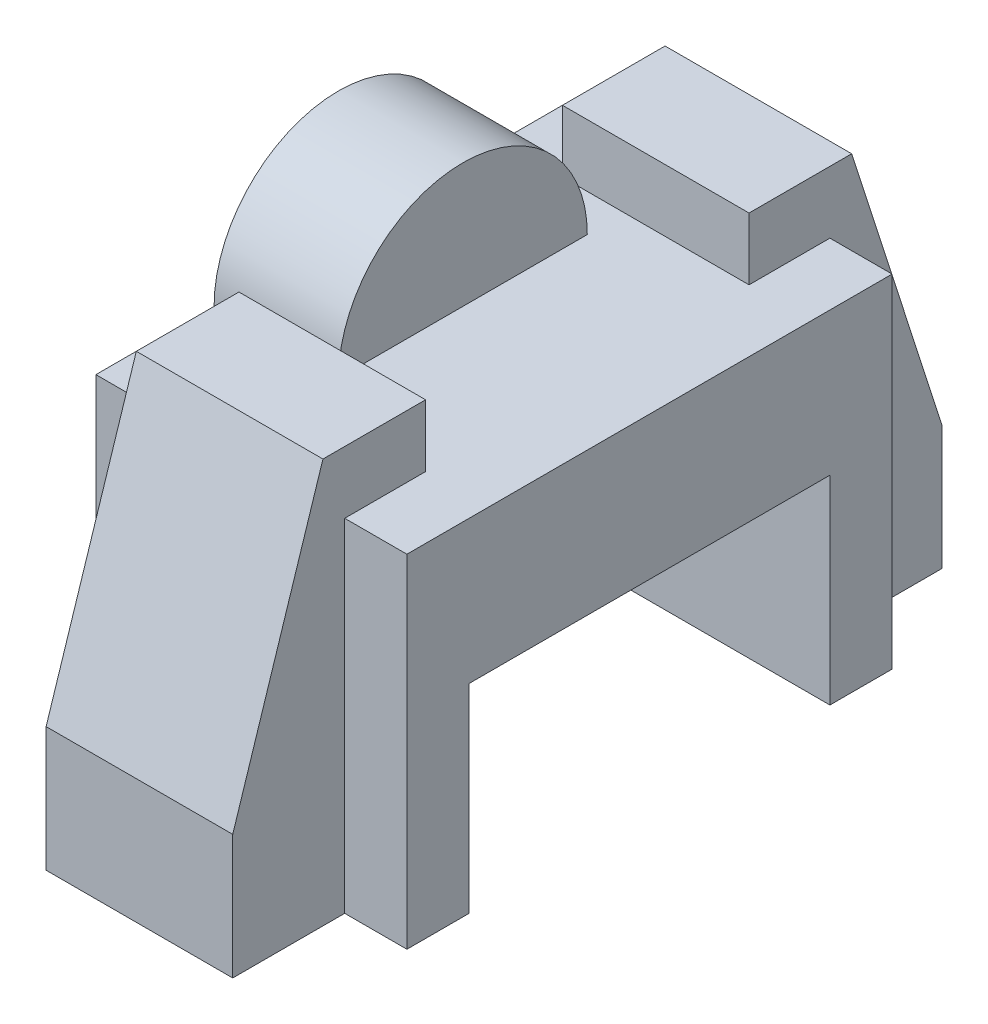
from build123d import *

# Parameters (mm, degrees)
SALIENTE_EXTRUIR1_DEPTH = 25
SALIENTE_EXTRUIR2_DEPTH = 15
SALIENTE_EXTRUIR3_START = -25
SALIENTE_EXTRUIR3_DEPTH = 20


with BuildPart() as part:
    # Croquis1 → Saliente-Extruir1 (new, symmetric)
    with BuildSketch(Plane(origin=(0, 0, 0), x_dir=(0, 0, -1), z_dir=(1, 0, 0))):
        Polygon((29, -27.5), (39, -27.5), (39, 27.5), (-39, 27.5), (-39, -27.5), (-29, -27.5), (-29, 4.5), (29, 4.5), align=None)
    extrude(amount=SALIENTE_EXTRUIR1_DEPTH, both=True)

    # Croquis2 → Saliente-Extruir2 (add, symmetric)
    with BuildSketch(Plane(origin=(0, 0, 0), x_dir=(0, 0, -1), z_dir=(1, 0, 0))):
        Polygon((-26, 27.5), (-26, 37.5), (-42.5, 37.5), (-57, -7.5), (-57, -27.5), (-39, -27.5), (-39, 27.5), align=None)
        Polygon((39, -27.5), (39, 27.5), (26, 27.5), (26, 37.5), (42.5, 37.5), (57, -7.5), (57, -27.5), align=None)
    extrude(amount=SALIENTE_EXTRUIR2_DEPTH, both=True)

    # Croquis3 → Saliente-Extruir3 (add)
    with BuildSketch(Plane(origin=(0, 0, 0), x_dir=(0, 0, -1), z_dir=(1, 0, 0)).offset(SALIENTE_EXTRUIR3_START)):
        with BuildLine():
            Line((-20, 27.5), (20, 27.5))
            ThreePointArc((20, 27.5), (0, 47.5), (-20, 27.5))
        make_face()
    extrude(amount=SALIENTE_EXTRUIR3_DEPTH)


solid = part.part
